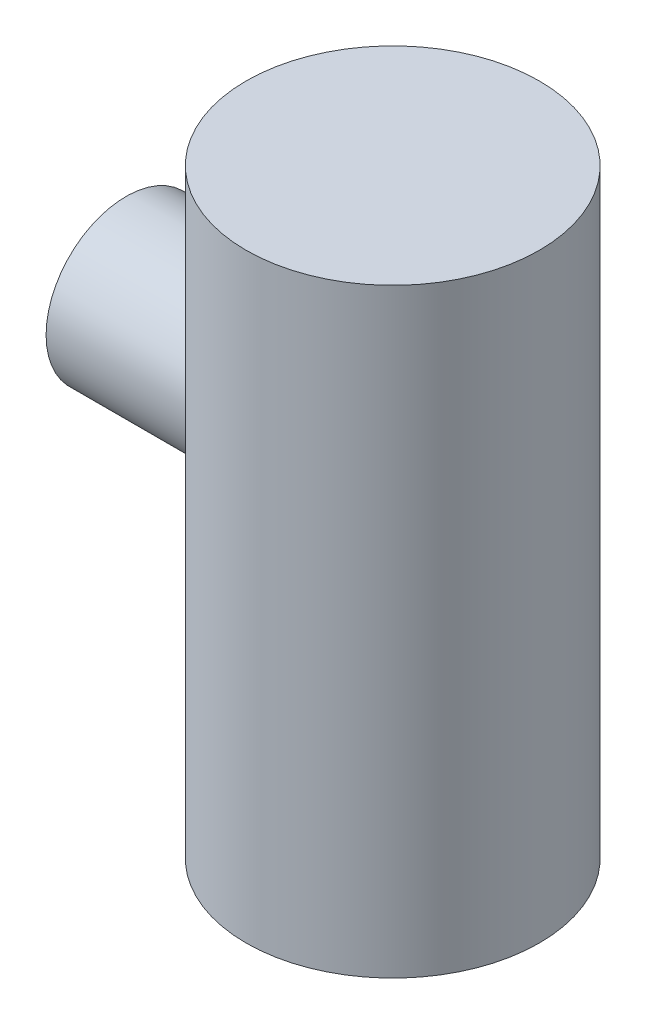
from build123d import *

# Parameters (mm, degrees)
SKETCH1_R           = 27.94
BOSS_EXTRUDE1_DEPTH = 114.3
SKETCH2_W           = 28.65102891
SKETCH2_H           = 3.175
SKETCH3_R           = 3.175
OUTLET_DEPTH        = 25.4
SKETCH4_W           = 50.8
SKETCH4_H           = 15.24


with BuildPart() as part:
    # Sketch1 → Boss-Extrude1 (new body)
    with BuildSketch(Plane(origin=(0, 0, 0), x_dir=(1, 0, 0), z_dir=(0, 1, 0))):
        with Locations(Location((0, 0, 0), (0, 0, 270))):
            Circle(SKETCH1_R)
    extrude(amount=BOSS_EXTRUDE1_DEPTH)

    # Sketch2 → inlet (revolve, cut)
    with BuildSketch(Plane.XY):
        with Locations((-29.319058082, 26.9875)):
            Rectangle(SKETCH2_W, SKETCH2_H)
    revolve(axis=Axis((-14.993543627, 25.4, 0), (-1, 0, 0)), mode=Mode.SUBTRACT)

    # Sketch3 → outlet (cut)
    with BuildSketch(Plane.XZ):
        with Locations(Location((0, 0, 0), (0, 0, 270))):
            Circle(SKETCH3_R)
    extrude(amount=-OUTLET_DEPTH, mode=Mode.SUBTRACT)

    # Sketch4 → Revolve1 (revolve)
    with BuildSketch(Plane.XY, mode=Mode.PRIVATE) as revolve1_sk:
        with Locations((-25.4, 76.2)):
            Rectangle(SKETCH4_W, SKETCH4_H)
    revolve(revolve1_sk.sketch.rotate(Axis((-50.8, 68.58, 0), (1, 0, 0)), 90), axis=Axis((-50.8, 68.58, 0), (1, 0, 0)))

    # Sketch6 → 1/2 NPT Tapped Hole1 (revolve, cut)
    with BuildSketch(Plane(origin=(-50.8, 68.58, 0), x_dir=(0, 0, 1), z_dir=(0, 1, 0))):
        Polygon((0, 0), (0, 27.970543693), (8.9281, 22.606), (8.9281, 13.462), (10.280678542, 13.462), (10.6647361, 0.635), (11.2997361, 0), align=None)
    revolve(axis=Axis((-57.15, 68.58, 0), (1, 0, 0)), mode=Mode.SUBTRACT)


solid = part.part
